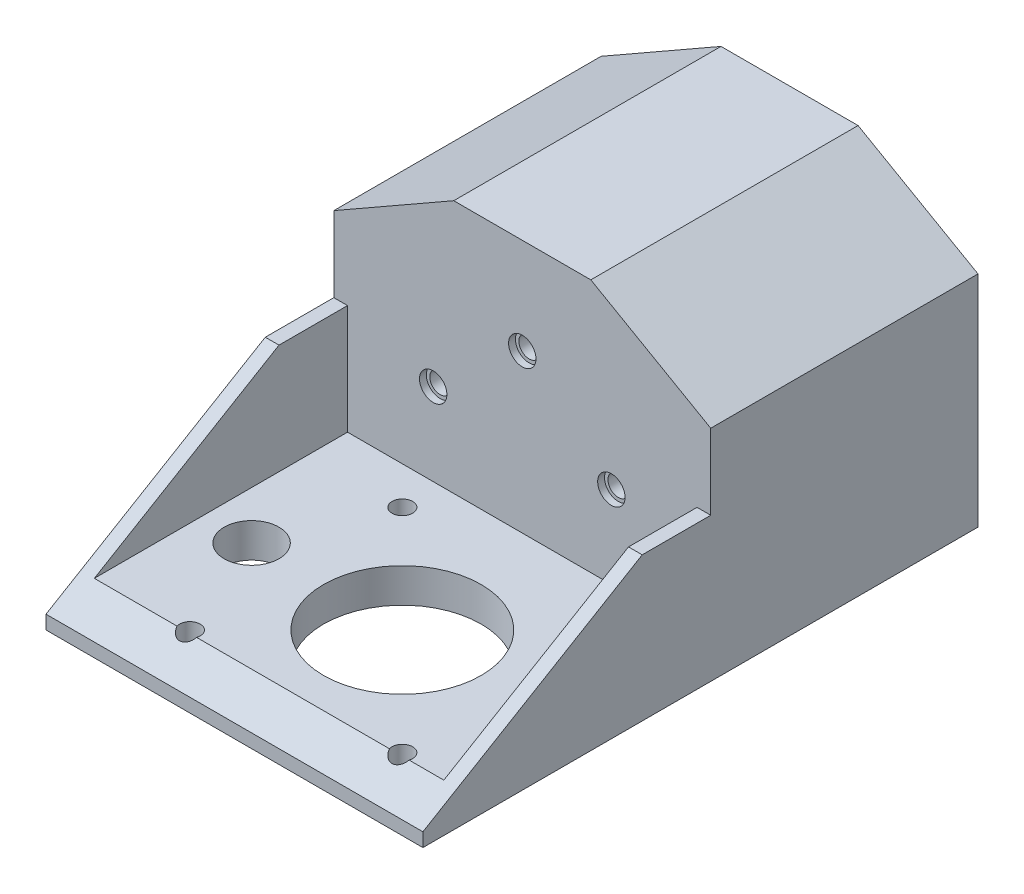
from build123d import *

# Parameters (mm, degrees)
BOSS_EXTRUDE1_DEPTH = 39
SKETCH2_W           = 55
SKETCH2_H           = 5
BOSS_EXTRUDE2_DEPTH = 42
SKETCH3_R           = 1.5
SKETCH3_R_2         = 4
SKETCH3_R_3         = 11.5
CUT_EXTRUDE1_DEPTH  = 105.66613588
SKETCH4_R           = 1.5
CUT_EXTRUDE2_DEPTH  = 81.950602221
SKETCH5_R           = 2
CUT_EXTRUDE3_DEPTH  = 1
SKETCH6_W           = 2
SKETCH6_H           = 42
BOSS_EXTRUDE3_DEPTH = 16
CUT_EXTRUDE4_DEPTH  = 70


with BuildPart() as part:
    # Sketch1 → Boss-Extrude1 (new body)
    with BuildSketch(Plane.XY):
        Polygon((0, 0), (55, 0), (55, 32), (37.5, 42), (17.5, 42), (0, 32), align=None)
    extrude(amount=BOSS_EXTRUDE1_DEPTH)

    # Sketch2 → Boss-Extrude2 (add)
    with BuildSketch(Plane.XY.offset(39)):
        with Locations((27.5, 2.5)):
            Rectangle(SKETCH2_W, SKETCH2_H)
    extrude(amount=BOSS_EXTRUDE2_DEPTH)

    # Sketch3 → Cut-Extrude1 (cut, through all)
    with BuildSketch(Plane(origin=(0, 5, 0), x_dir=(1, 0, 0), z_dir=(0, 1, 0))):
        with Locations(Location((15.5, -44.5, 0), (0, 0, 180))):
            Circle(SKETCH3_R)
        with Locations(Location((46.5, -44.5, 0), (0, 0, 180))):
            Circle(SKETCH3_R)
        with Locations(Location((46.5, -75.5, 0), (0, 0, 180))):
            Circle(SKETCH3_R)
        with Locations(Location((15.5, -75.5, 0), (0, 0, 180))):
            Circle(SKETCH3_R)
        with Locations(Location((9, -60, 0), (0, 0, 180))):
            Circle(SKETCH3_R_2)
        with Locations(Location((31, -60, 0), (0, 0, 180))):
            Circle(SKETCH3_R_3)
    extrude(amount=-CUT_EXTRUDE1_DEPTH, mode=Mode.SUBTRACT)

    # Sketch4 → Cut-Extrude2 (cut, through all)
    with BuildSketch(Plane.XY.offset(39)):
        with Locations((27.5, 28)):
            Circle(SKETCH4_R)
        with Locations((40.5, 17)):
            Circle(SKETCH4_R)
        with Locations(Location((14.5, 17, 0), (0, 0, 180))):
            Circle(SKETCH4_R)
    extrude(amount=-CUT_EXTRUDE2_DEPTH, mode=Mode.SUBTRACT)

    # Sketch5 → Cut-Extrude3 (cut)
    with BuildSketch(Plane.XY.offset(39)):
        with Locations((27.5, 28)):
            Circle(SKETCH5_R)
        with Locations((40.5, 17)):
            Circle(SKETCH5_R)
        with Locations((14.5, 17)):
            Circle(SKETCH5_R)
    extrude(amount=-CUT_EXTRUDE3_DEPTH, mode=Mode.SUBTRACT)

    # Sketch6 → Boss-Extrude3 (add)
    with BuildSketch(Plane(origin=(0, 5, 0), x_dir=(1, 0, 0), z_dir=(0, 1, 0))):
        with Locations((1, -60)):
            Rectangle(SKETCH6_W, SKETCH6_H)
        with Locations((54, -60)):
            Rectangle(SKETCH6_W, SKETCH6_H)
    extrude(amount=BOSS_EXTRUDE3_DEPTH)

    # Sketch7 → Cut-Extrude4 (cut)
    with BuildSketch(Plane(origin=(55, 0, 0), x_dir=(0, 0, -1), z_dir=(1, 0, 0))):
        Polygon((-49, 21), (-81, 21), (-81, 2), align=None)
    extrude(amount=-CUT_EXTRUDE4_DEPTH, mode=Mode.SUBTRACT)


solid = part.part
